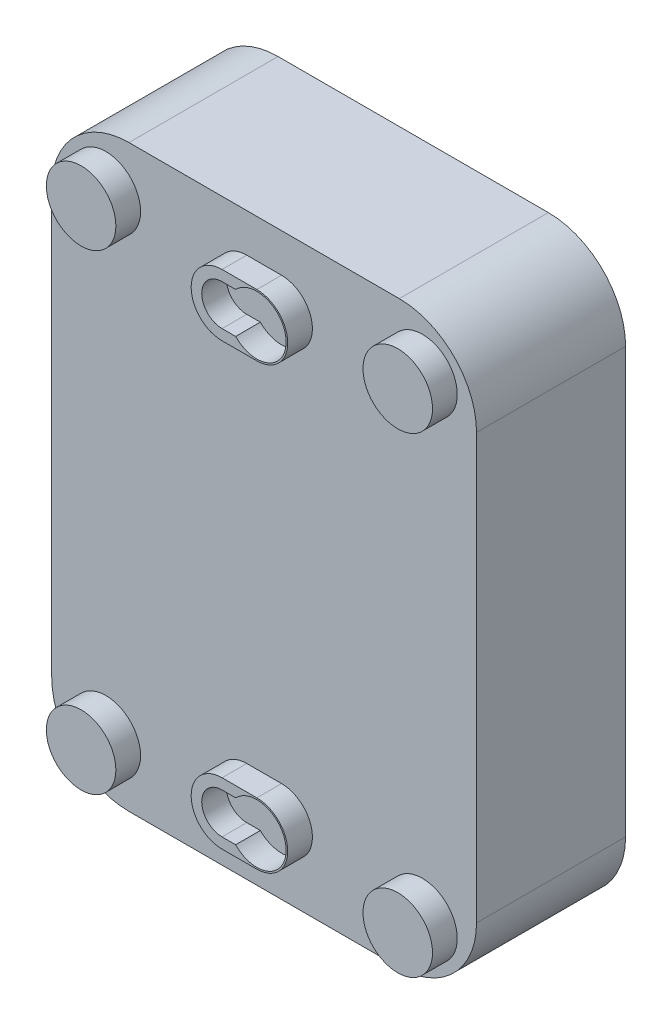
from build123d import *

# Parameters (mm, degrees)
SKETCH1_W           = 69.85
SKETCH1_H           = 95.25
BOSS_EXTRUDE1_DEPTH = 28.575
FILLET1_R           = 12.7
SKETCH2_OUTSIDE_W   = 96.154
SKETCH2_OUTSIDE_H   = 121.554
SKETCH2_OUTSIDE_R   = 5.715
CUT_EXTRUDE1_DEPTH  = 4.064


with BuildPart() as part:
    # Sketch1 → Boss-Extrude1 (new body)
    with BuildSketch(Plane.XY):
        with Locations((34.925, 47.625)):
            Rectangle(SKETCH1_W, SKETCH1_H)
    extrude(amount=BOSS_EXTRUDE1_DEPTH)

    # Fillet1
    fillet1_edges = [part.edges().sort_by_distance(p)[0] for p in [
        (0, 95.25, 14.2875),
        (69.85, 95.25, 14.2875),
        (69.85, 0, 14.2875),
        (0, 0, 14.2875),
    ]]
    fillet(fillet1_edges, radius=FILLET1_R)

    # Sketch2 outside → Cut-Extrude1 (cut)
    # profile 1 of 3: a face of its own
    with BuildSketch(Plane.XY.offset(28.575)):
        with Locations((34.925, 47.625)):
            Rectangle(SKETCH2_OUTSIDE_W, SKETCH2_OUTSIDE_H)
        with Locations((60.96, 8.89)):
            Circle(SKETCH2_OUTSIDE_R, mode=Mode.SUBTRACT)
        with Locations((8.89, 8.89)):
            Circle(SKETCH2_OUTSIDE_R, mode=Mode.SUBTRACT)
        with Locations((8.89, 86.36)):
            Circle(SKETCH2_OUTSIDE_R, mode=Mode.SUBTRACT)
        with Locations((60.96, 86.36)):
            Circle(SKETCH2_OUTSIDE_R, mode=Mode.SUBTRACT)
        with BuildLine():
            Line((37.7825, 6.35), (32.0675, 6.35))
            ThreePointArc((32.0675, 6.35), (26.9875, 11.43), (32.0675, 16.51))
            Line((32.0675, 16.51), (37.7825, 16.51))
            ThreePointArc((37.7825, 16.51), (42.8625, 11.43), (37.7825, 6.35))
        make_face(mode=Mode.SUBTRACT)
        with BuildLine():
            Line((37.7825, 78.74), (32.0675, 78.74))
            ThreePointArc((32.0675, 78.74), (26.9875, 83.82), (32.0675, 88.9))
            Line((32.0675, 88.9), (37.7825, 88.9))
            ThreePointArc((37.7825, 88.9), (42.8625, 83.82), (37.7825, 78.74))
        make_face(mode=Mode.SUBTRACT)
    # profile 2 of 3: a face of its own
    with BuildSketch(Plane.XY.offset(28.575)):
        with BuildLine():
            Line((32.0675, 14.77282006), (34.301719909, 14.77282006))
            ThreePointArc((34.301719909, 14.77282006), (42.6085, 11.43), (34.301719909, 8.08717994))
            Line((34.301719909, 8.08717994), (32.0675, 8.08717994))
            ThreePointArc((32.0675, 8.08717994), (28.72467994, 11.43), (32.0675, 14.77282006))
        make_face()
    # profile 3 of 3: a face of its own
    with BuildSketch(Plane.XY.offset(28.575)):
        with BuildLine():
            Line((32.0675, 80.47717994), (34.301719909, 80.47717994))
            ThreePointArc((34.301719909, 80.47717994), (42.6085, 83.82), (34.301719909, 87.16282006))
            Line((34.301719909, 87.16282006), (32.0675, 87.16282006))
            ThreePointArc((32.0675, 87.16282006), (28.72467994, 83.82), (32.0675, 80.47717994))
        make_face()
    extrude(amount=-CUT_EXTRUDE1_DEPTH, mode=Mode.SUBTRACT)


solid = part.part
